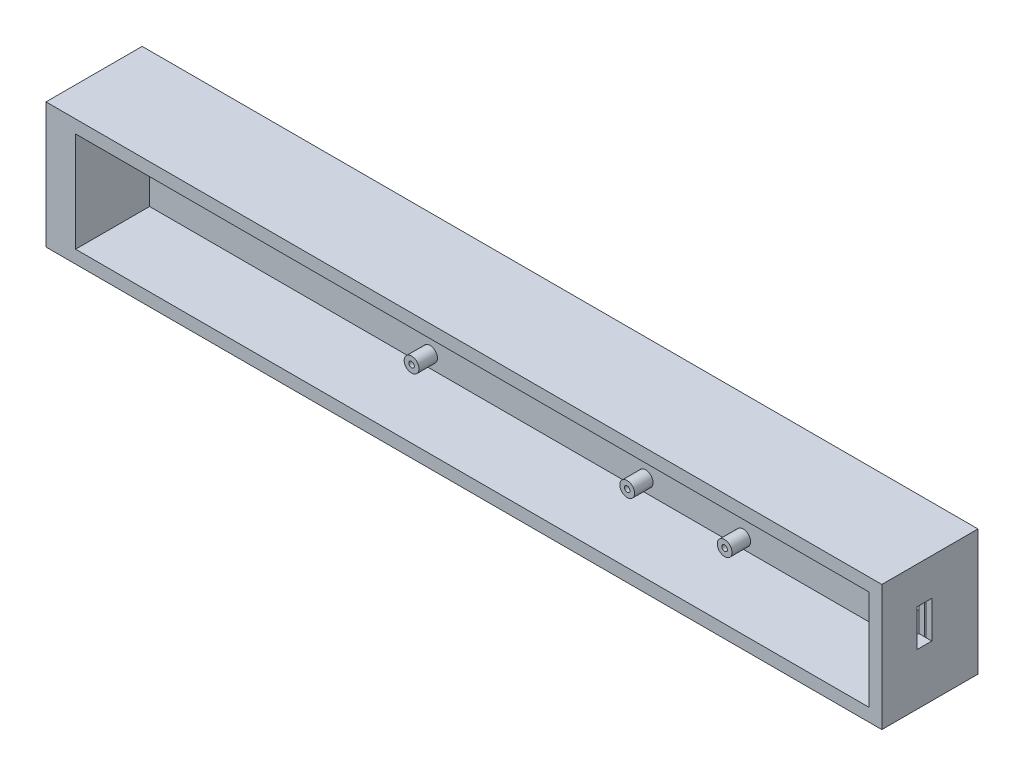
from build123d import *

# Parameters (mm, degrees)
SKETCH_1_W          = 226
SKETCH_1_H          = 34
SKETCH_1_W_2        = 216
SKETCH_1_H_2        = 8.2
EXTRUDE_1_DEPTH     = 6
SKETCH_2_R          = 2
EXTRUDE_2_DEPTH     = 5
SKETCH_3_R          = 0.75
CUT_EXTRUDE_1_DEPTH = 5
SKETCH_4_W          = 226
SKETCH_4_H          = 34
SKETCH_4_W_2        = 210
SKETCH_4_H_2        = 27
EXTRUDE_3_DEPTH     = 2
SKETCH_6_W          = 226
SKETCH_6_H          = 34
SKETCH_6_W_2        = 214.5
SKETCH_6_H_2        = 27
EXTRUDE_4_DEPTH     = 18
SKETCH_7_W          = 1.5
SKETCH_7_H          = 27
CUT_EXTRUDE_2_DEPTH = 2
SKETCH_8_R          = 2
EXTRUDE_5_DEPTH     = 5
SKETCH_9_R          = 0.75
CUT_EXTRUDE_3_DEPTH = 5
SKETCH_10_W         = 4
SKETCH_10_H         = 10
CUT_EXTRUDE_4_DEPTH = 5


with BuildPart() as part:
    # Эскиз1 → Бобышка-Вытянуть1 (new body)
    with BuildSketch(Plane.XY):
        with Locations((108, 4.1)):
            Rectangle(SKETCH_1_W, SKETCH_1_H)
        with Locations((108, 4.1)):
            Rectangle(SKETCH_1_W_2, SKETCH_1_H_2, mode=Mode.SUBTRACT)
    extrude(amount=EXTRUDE_1_DEPTH)

    # Эскиз2 → Бобышка-Вытянуть2 (add)
    with BuildSketch(Plane.XY.offset(6)):
        with Locations((78.85, 14.2)):
            Circle(SKETCH_2_R)
        with Locations((78.85, -6)):
            Circle(SKETCH_2_R)
        with Locations((137.15, 14.2)):
            Circle(SKETCH_2_R)
        with Locations((137.15, -6)):
            Circle(SKETCH_2_R)
    extrude(amount=EXTRUDE_2_DEPTH)

    # Эскиз3 → Вырез-Вытянуть1 (cut)
    with BuildSketch(Plane.XY.offset(11)):
        with Locations((78.85, 14.2)):
            Circle(SKETCH_3_R)
        with Locations((78.85, -6)):
            Circle(SKETCH_3_R)
        with Locations((137.15, 14.2)):
            Circle(SKETCH_3_R)
        with Locations((137.15, -6)):
            Circle(SKETCH_3_R)
    extrude(amount=-CUT_EXTRUDE_1_DEPTH, mode=Mode.SUBTRACT)

    # Эскиз4 → Бобышка-Вытянуть3 (add)
    with BuildSketch(Plane.XY.offset(6)):
        with Locations((108, 4.1)):
            Rectangle(SKETCH_4_W, SKETCH_4_H)
        with Locations((108, 4.1)):
            Rectangle(SKETCH_4_W_2, SKETCH_4_H_2, mode=Mode.SUBTRACT)
    extrude(amount=EXTRUDE_3_DEPTH)

    # Эскиз6 → Бобышка-Вытянуть4 (add)
    with BuildSketch(Plane.XY.offset(8)):
        with Locations((108, 4.1)):
            Rectangle(SKETCH_6_W, SKETCH_6_H)
        with Locations((110.25, 4.1)):
            Rectangle(SKETCH_6_W_2, SKETCH_6_H_2, mode=Mode.SUBTRACT)
    extrude(amount=EXTRUDE_4_DEPTH)

    # Эскиз7 → Вырез-Вытянуть2 (cut)
    with BuildSketch(Plane.ZY.offset(-217.5)):
        with Locations((11.75, 4.1)):
            Rectangle(SKETCH_7_W, SKETCH_7_H)
    extrude(amount=-CUT_EXTRUDE_2_DEPTH, mode=Mode.SUBTRACT)

    # Эскиз8 → Бобышка-Вытянуть5 (add)
    with BuildSketch(Plane.XY.offset(6)):
        with Locations((163.5, 14.85)):
            Circle(SKETCH_8_R)
        with Locations((163.5, -6.65)):
            Circle(SKETCH_8_R)
    extrude(amount=EXTRUDE_5_DEPTH)

    # Эскиз9 → Вырез-Вытянуть3 (cut)
    with BuildSketch(Plane.XY.offset(11)):
        with Locations((163.5, 14.85)):
            Circle(SKETCH_9_R)
        with Locations((163.5, -6.65)):
            Circle(SKETCH_9_R)
    extrude(amount=-CUT_EXTRUDE_3_DEPTH, mode=Mode.SUBTRACT)

    # Эскиз10 → Вырез-Вытянуть4 (cut)
    with BuildSketch(Plane.ZY.offset(-217.5)):
        with Locations((14.5, 6.1)):
            Rectangle(SKETCH_10_W, SKETCH_10_H)
    extrude(amount=-CUT_EXTRUDE_4_DEPTH, mode=Mode.SUBTRACT)


solid = part.part
